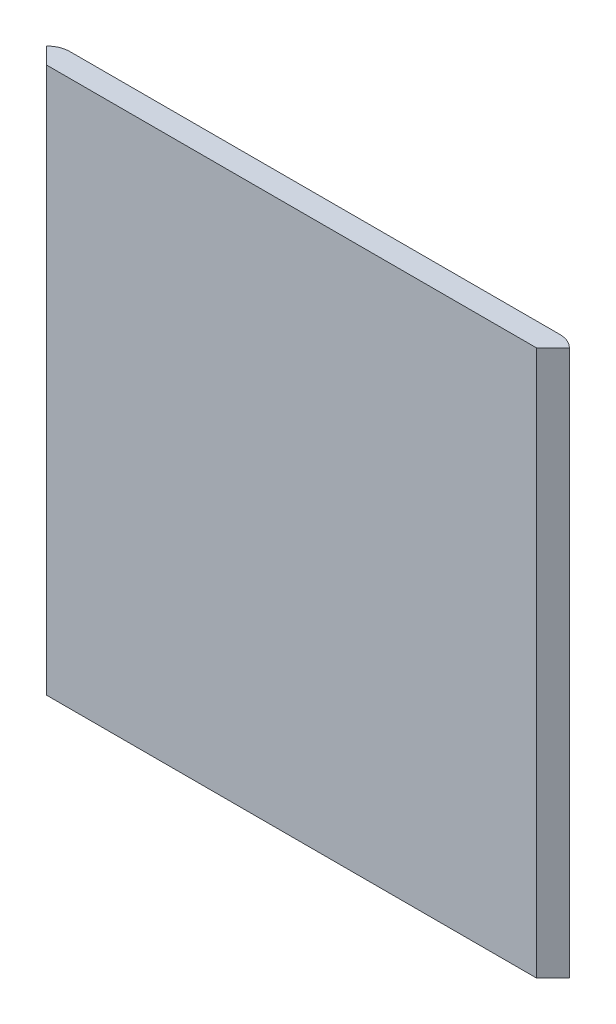
from build123d import *

# Parameters (mm, degrees)
SKETCH1_W           = 105
SKETCH1_H           = 117
BOSS_EXTRUDE1_DEPTH = 5
BOSS_EXTRUDE2_DEPTH = 117


with BuildPart() as part:
    # Sketch1 → Boss-Extrude1 (new body)
    with BuildSketch(Plane.XY):
        Rectangle(SKETCH1_W, SKETCH1_H)
    extrude(amount=BOSS_EXTRUDE1_DEPTH)


with BuildPart() as body_2:
    # Sketch2 → Boss-Extrude2 (new body)
    with BuildSketch(Plane.XZ.offset(58.5)):
        with BuildLine():
            ThreePointArc((-52.5, 0), (-54.413417162, 0.380602337), (-56.035533906, 1.464466094))
            Line((-56.035533906, 1.464466094), (-52.5, 5))
            Line((-52.5, 5), (-52.5, 0))
        make_face()
    extrude(amount=-BOSS_EXTRUDE2_DEPTH)


with BuildPart() as body_3:
    # Mirror1: mirrored copy
    add(body_2.part.mirror(Plane.ZY))


with BuildPart() as body_2_1:
    add(body_2.part)

    # Combine1: union body 3, part
    add(body_3.part)
    add(part.part)


solid = body_2_1.part
